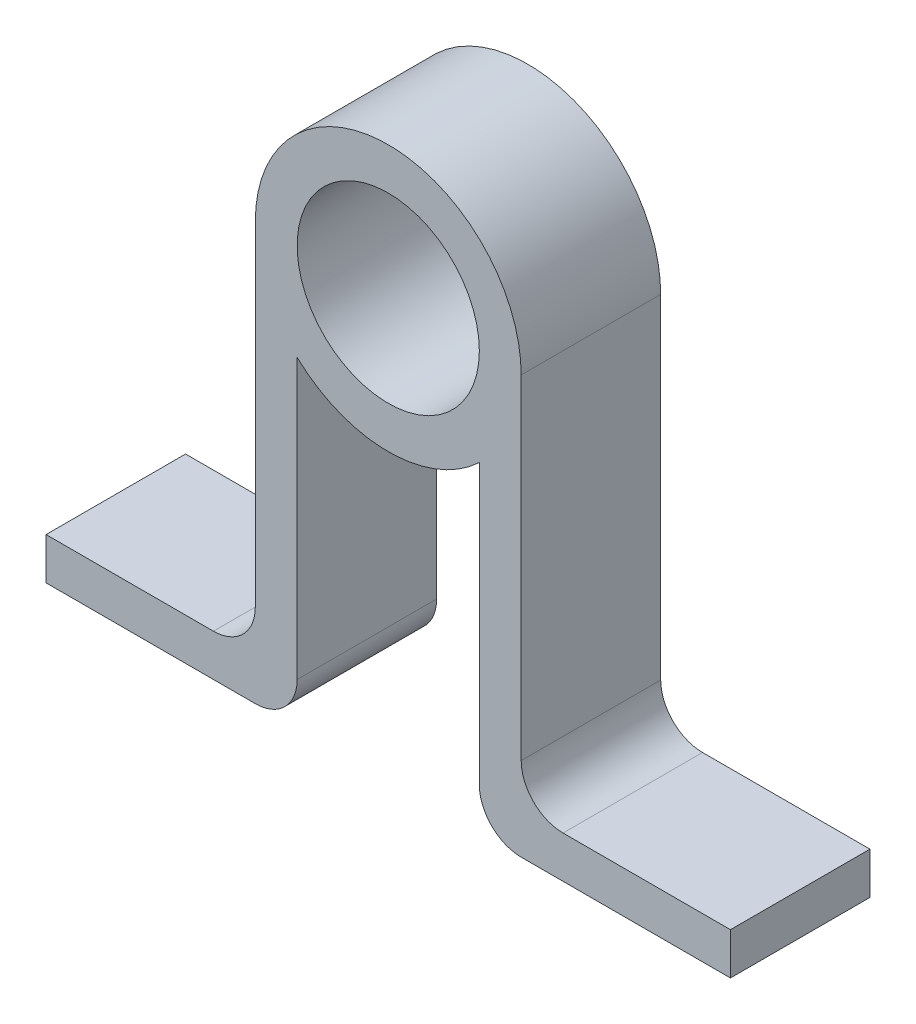
from build123d import *

# Parameters (mm, degrees)
SKETCH1_R           = 6.53
BOSS_EXTRUDE1_DEPTH = 10


with BuildPart() as part:
    # Sketch1 → Boss-Extrude1 (new body)
    with BuildSketch(Plane.XY):
        with BuildLine():
            Line((6.53, -6.941181456), (6.53, -26.94))
            ThreePointArc((6.53, -26.94), (7.408679656, -29.061320344), (9.53, -29.94))
            Line((9.53, -29.94), (24.53, -29.94))
            Line((24.53, -29.94), (24.53, -26.94))
            Line((24.53, -26.94), (12.53, -26.94))
            ThreePointArc((12.53, -26.94), (10.408679656, -26.061320344), (9.53, -23.94))
            Line((9.53, -23.94), (9.53, 0))
            ThreePointArc((9.53, 0), (0, 9.53), (-9.53, 0))
            Line((-9.53, 0), (-9.53, -23.94))
            ThreePointArc((-9.53, -23.94), (-10.408679656, -26.061320344), (-12.53, -26.94))
            Line((-12.53, -26.94), (-24.53, -26.94))
            Line((-24.53, -26.94), (-24.53, -29.94))
            Line((-24.53, -29.94), (-9.53, -29.94))
            ThreePointArc((-9.53, -29.94), (-7.408679656, -29.061320344), (-6.53, -26.94))
            Line((-6.53, -26.94), (-6.53, -6.941181456))
            ThreePointArc((-6.53, -6.941181456), (0, -9.53), (6.53, -6.941181456))
        make_face()
        Circle(SKETCH1_R, mode=Mode.SUBTRACT)
    extrude(amount=BOSS_EXTRUDE1_DEPTH)


solid = part.part
